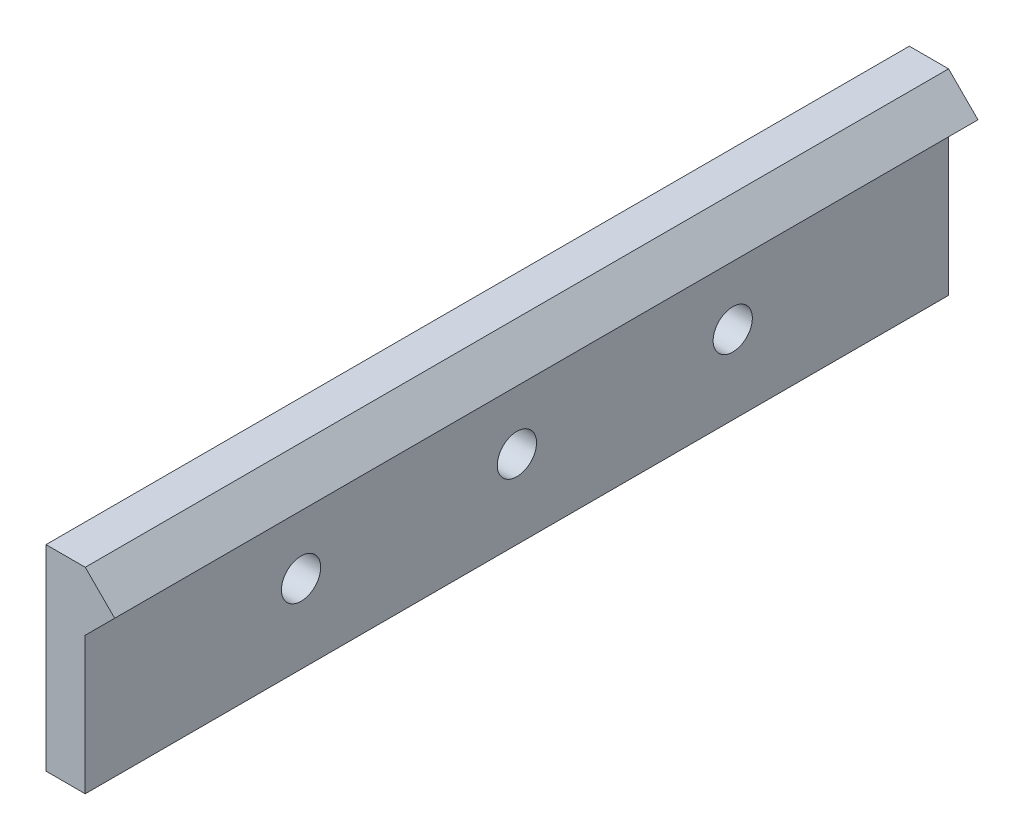
from build123d import *

# Parameters (mm, degrees)
BOSS_EXTRUDE1_DEPTH = 139.7
SKETCH2_R           = 6.35
CUT_EXTRUDE1_DEPTH  = 38.1


with BuildPart() as part:
    # Sketch1 → Boss-Extrude1 (new, symmetric)
    with BuildSketch(Plane.XY):
        Polygon((6.35, 63.5), (15.875, 53.975), (6.35, 44.45), (6.35, 0), (-6.35, 0), (-6.35, 63.5), align=None)
    extrude(amount=BOSS_EXTRUDE1_DEPTH, both=True)

    # Sketch2 → Cut-Extrude1 (cut, symmetric)
    with BuildSketch(Plane(origin=(0, 0, 0), x_dir=(0, 0, -1), z_dir=(1, 0, 0))):
        with Locations((-69.85, 25.4)):
            Circle(SKETCH2_R)
        with Locations((0, 25.4)):
            Circle(SKETCH2_R)
        with Locations((69.85, 25.4)):
            Circle(SKETCH2_R)
    extrude(amount=CUT_EXTRUDE1_DEPTH, both=True, mode=Mode.SUBTRACT)


solid = part.part
